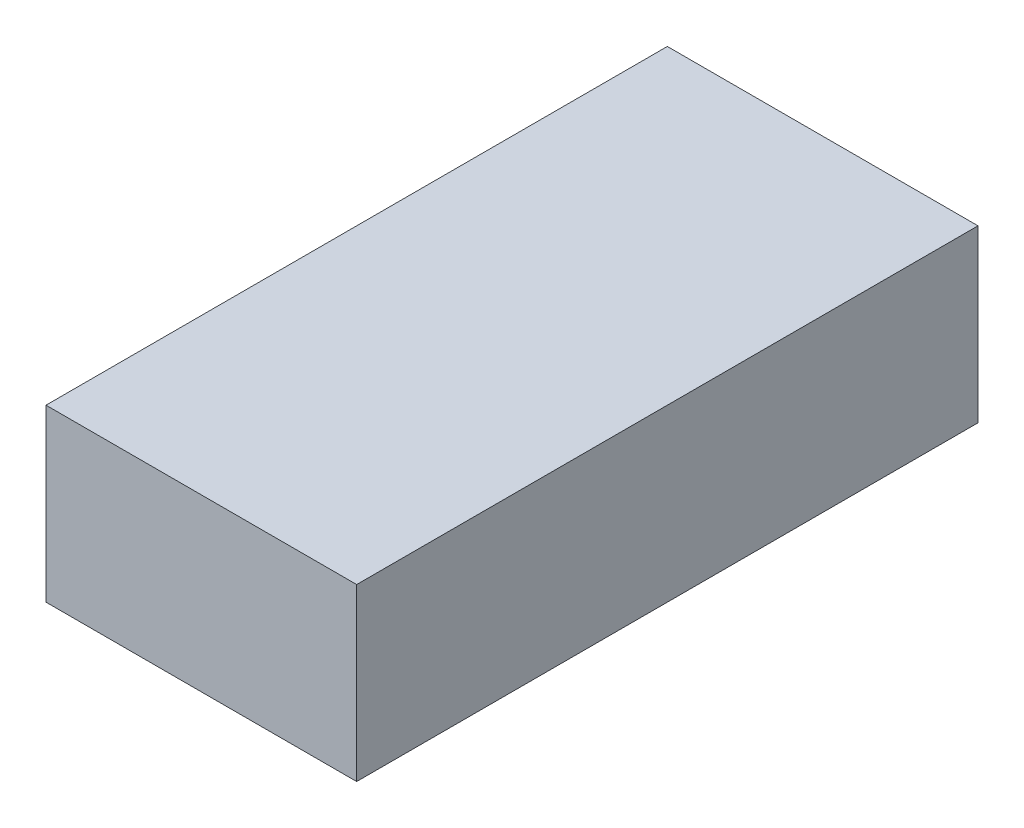
from build123d import *

# Parameters (mm, degrees)
SKETCH1_W           = 5.08
SKETCH1_H           = 10.16
BOSS_EXTRUDE1_DEPTH = 2.79


with BuildPart() as part:
    # Sketch1 → Boss-Extrude1 (new body)
    with BuildSketch(Plane(origin=(0, 0, 0), x_dir=(1, 0, 0), z_dir=(0, 1, 0))):
        Rectangle(SKETCH1_W, SKETCH1_H)
    extrude(amount=BOSS_EXTRUDE1_DEPTH)


solid = part.part
